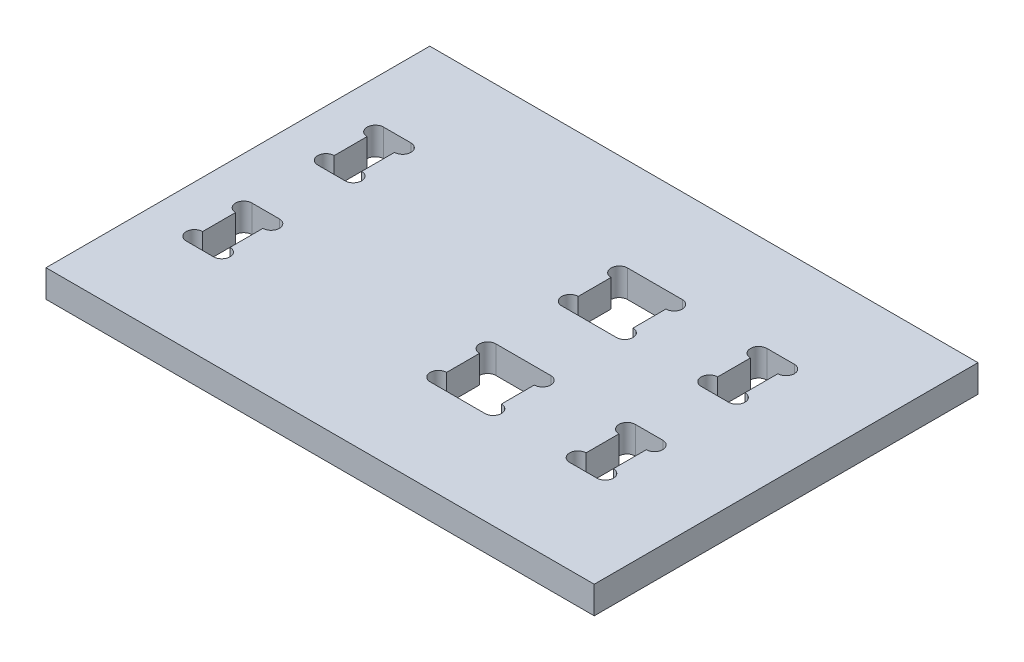
from build123d import *

# Parameters (mm, degrees)
SKETCH_1_W          = 100
SKETCH_1_H          = 70
EXTRUDE_1_DEPTH     = 5
SKETCH_2_W          = 10
SKETCH_2_H          = 12
SKETCH_2_W_2        = 5
CUT_EXTRUDE_1_DEPTH = 10
SKETCH_3_R          = 1.5
CUT_EXTRUDE_2_DEPTH = 5


with BuildPart() as part:
    # 스케치1 → 보스-돌출1 (new body)
    with BuildSketch(Plane(origin=(0, 0, 0), x_dir=(1, 0, 0), z_dir=(0, 1, 0))):
        with Locations((50, 35)):
            Rectangle(SKETCH_1_W, SKETCH_1_H)
    extrude(amount=EXTRUDE_1_DEPTH)

    # 스케치2 → 컷-돌출1 (cut)
    with BuildSketch(Plane(origin=(0, 5, 0), x_dir=(1, 0, 0), z_dir=(0, 1, 0))):
        with Locations((58.07, 47)):
            Rectangle(SKETCH_2_W, SKETCH_2_H)
        with Locations((58.07, 23)):
            Rectangle(SKETCH_2_W, SKETCH_2_H)
        with Locations((81, 47)):
            Rectangle(SKETCH_2_W_2, SKETCH_2_H)
        with Locations((81, 23)):
            Rectangle(SKETCH_2_W_2, SKETCH_2_H)
        with Locations((11.07, 47)):
            Rectangle(SKETCH_2_W_2, SKETCH_2_H)
        with Locations((11.07, 23)):
            Rectangle(SKETCH_2_W_2, SKETCH_2_H)
    extrude(amount=-CUT_EXTRUDE_1_DEPTH, mode=Mode.SUBTRACT)

    # 스케치3 → 컷-돌출2 (cut)
    with BuildSketch(Plane(origin=(0, 5, 0), x_dir=(1, 0, 0), z_dir=(0, 1, 0))):
        with Locations((8.57, 51.5)):
            Circle(SKETCH_3_R)
        with Locations((13.57, 51.5)):
            Circle(SKETCH_3_R)
        with Locations((8.57, 42.5)):
            Circle(SKETCH_3_R)
        with Locations((13.57, 42.5)):
            Circle(SKETCH_3_R)
        with Locations((8.57, 27.5)):
            Circle(SKETCH_3_R)
        with Locations((13.57, 27.5)):
            Circle(SKETCH_3_R)
        with Locations((13.57, 18.5)):
            Circle(SKETCH_3_R)
        with Locations((8.57, 18.5)):
            Circle(SKETCH_3_R)
        with Locations((63.07, 18.5)):
            Circle(SKETCH_3_R)
        with Locations((53.07, 18.5)):
            Circle(SKETCH_3_R)
        with Locations((53.07, 27.5)):
            Circle(SKETCH_3_R)
        with Locations((63.07, 27.5)):
            Circle(SKETCH_3_R)
        with Locations((78.5, 27.5)):
            Circle(SKETCH_3_R)
        with Locations((83.5, 27.5)):
            Circle(SKETCH_3_R)
        with Locations((78.5, 18.5)):
            Circle(SKETCH_3_R)
        with Locations((83.5, 18.5)):
            Circle(SKETCH_3_R)
        with Locations((78.5, 42.5)):
            Circle(SKETCH_3_R)
        with Locations((83.5, 42.5)):
            Circle(SKETCH_3_R)
        with Locations((78.5, 51.5)):
            Circle(SKETCH_3_R)
        with Locations((83.5, 51.5)):
            Circle(SKETCH_3_R)
        with Locations((63.07, 51.5)):
            Circle(SKETCH_3_R)
        with Locations((53.07, 51.5)):
            Circle(SKETCH_3_R)
        with Locations((53.07, 42.5)):
            Circle(SKETCH_3_R)
        with Locations((63.07, 42.5)):
            Circle(SKETCH_3_R)
    extrude(amount=-CUT_EXTRUDE_2_DEPTH, mode=Mode.SUBTRACT)


solid = part.part
